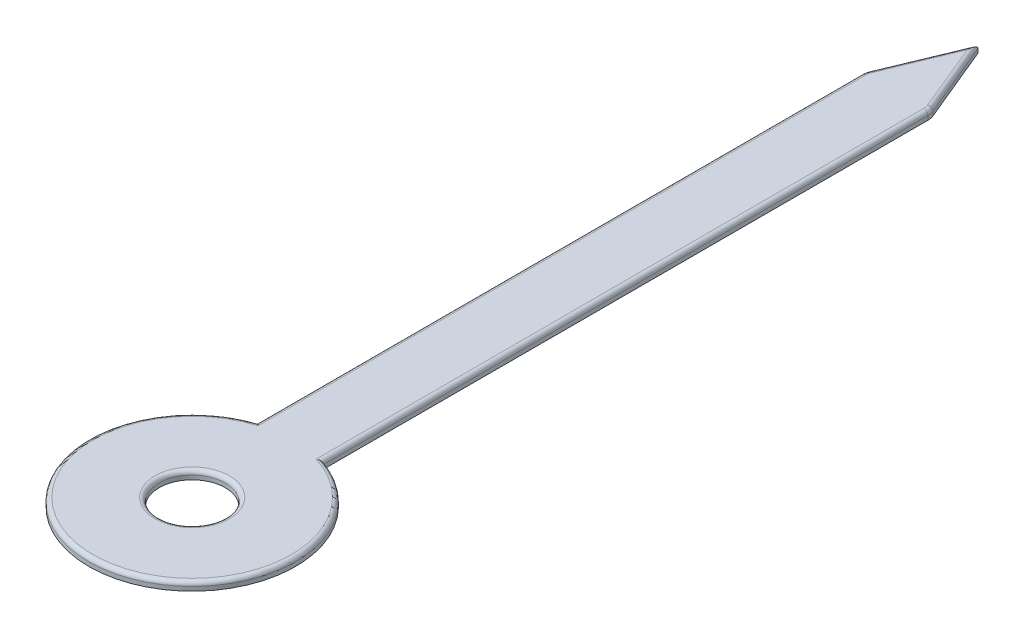
from build123d import *

# Parameters (mm, degrees)
SKETCH_1_R      = 0.4
EXTRUDE_2_DEPTH = 0.1
FILLET_2_R      = 0.2
FILLET_3_R      = 0.05


with BuildPart() as part:
    # 草图1 → 凸台-拉伸2 (new body)
    with BuildSketch(Plane(origin=(0, 0, 0), x_dir=(1, 0, 0), z_dir=(0, 1, 0))):
        with BuildLine():
            Line((0.4, 1.184271928), (0.4, 8.534314575))
            Line((0.4, 8.534314575), (0, 9.5))
            Line((0, 9.5), (-0.4, 8.534314575))
            Line((-0.4, 8.534314575), (-0.4, 1.184271928))
            ThreePointArc((-0.4, 1.184271928), (0, -1.25), (0.4, 1.184271928))
        make_face()
        with Locations(Location((0, 0, 0), (0, 0, 270))):
            Circle(SKETCH_1_R, mode=Mode.SUBTRACT)
    extrude(amount=EXTRUDE_2_DEPTH)

    # 圆角2
    fillet_2_edges = [part.edges().sort_by_distance(p)[0] for p in [
        (0.4, 0.05, -8.534314575),
        (-0.4, 0.05, -8.534314575),
    ]]
    fillet(fillet_2_edges, radius=FILLET_2_R)

    # 圆角3
    fillet_3_edges = [part.edges().sort_by_distance(p)[0] for p in [
        (0, 0.1, 1.25),
        (0, 0.1, -0.4),
        (0.4, 0.1, -4.839402015),
        (-0.4, 0.1, -4.839402015),
        (0.192387953, 0.1, -9.035534394),
        (0.396157056, 0.1, -8.533550166),
        (-0.396157056, 0.1, -8.533550166),
        (-0.192387953, 0.1, -9.035534394),
    ]]
    fillet(fillet_3_edges, radius=FILLET_3_R)


solid = part.part
